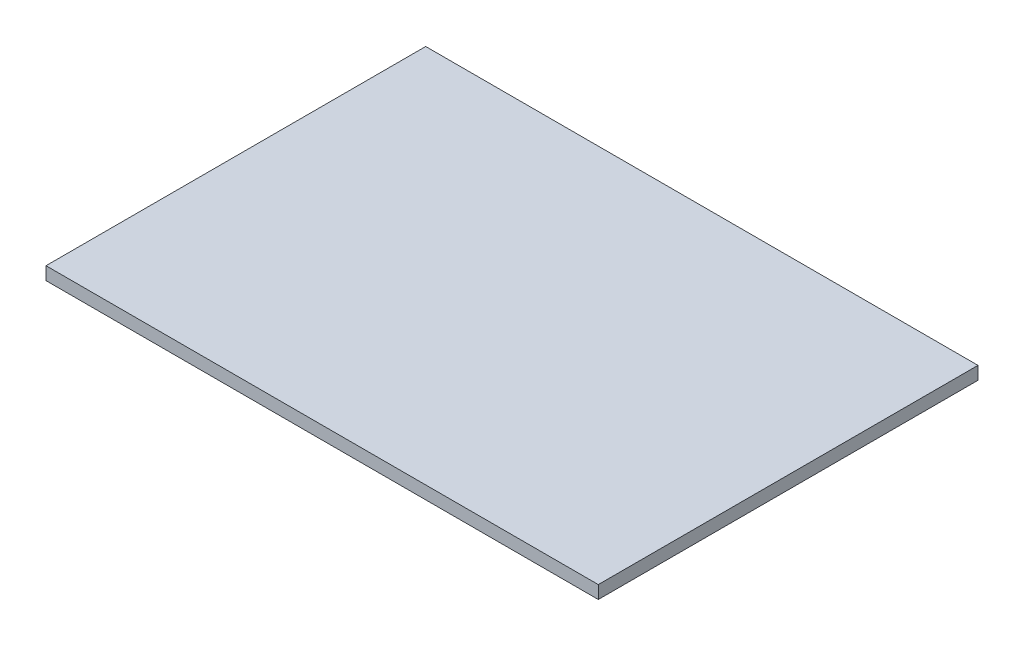
from build123d import *

# Parameters (mm, degrees)
SKETCH1_W           = 812.8
SKETCH1_H           = 558.8
BOSS_EXTRUDE1_DEPTH = 19.05


with BuildPart() as part:
    # Sketch1 → Boss-Extrude1 (new body)
    with BuildSketch(Plane(origin=(0, 0, 0), x_dir=(1, 0, 0), z_dir=(0, 1, 0))):
        with Locations((-133.00984602, 279.4)):
            Rectangle(SKETCH1_W, SKETCH1_H)
    extrude(amount=BOSS_EXTRUDE1_DEPTH)


solid = part.part
